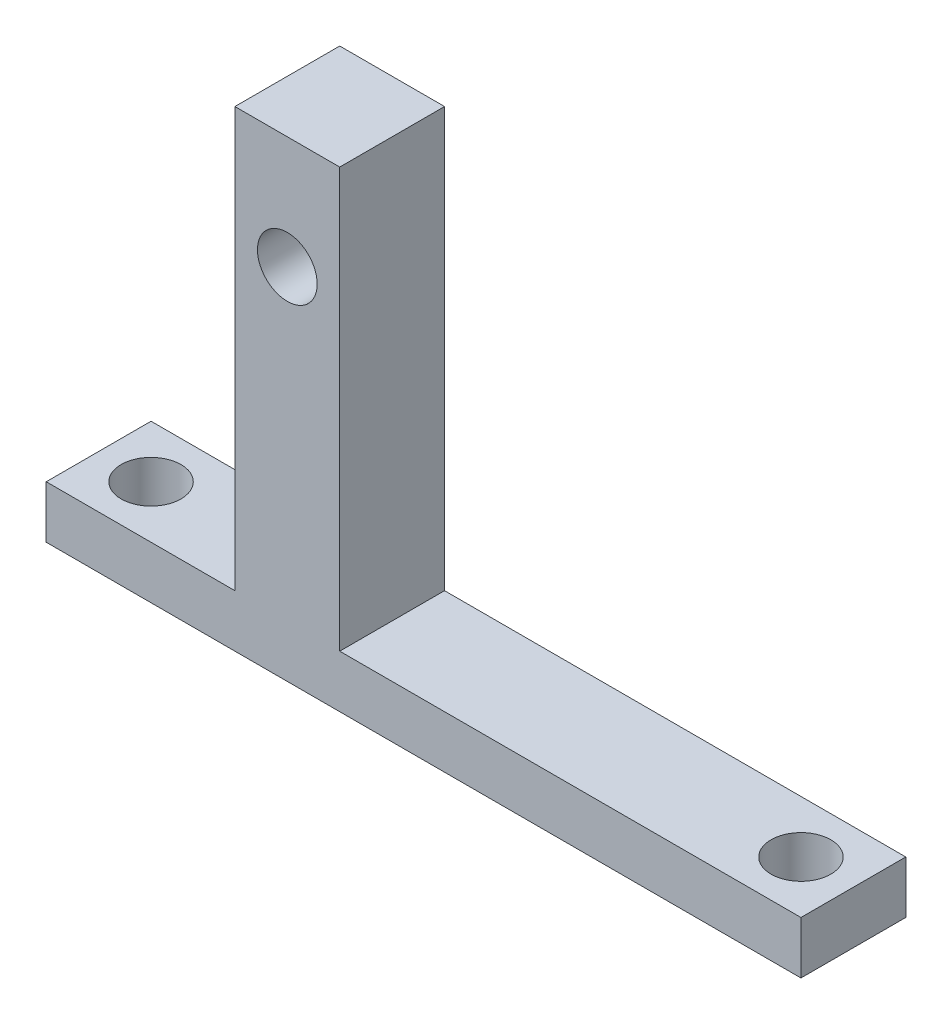
from build123d import *

# Parameters (mm, degrees)
SKETCH1_W           = 54.864
SKETCH1_H           = 7.62
BOSS_EXTRUDE1_DEPTH = 3.81
SKETCH2_R           = 2.1717
CUT_EXTRUDE2_DEPTH  = 3.81
SKETCH5_W           = 7.62
SKETCH5_H           = 7.62
BOSS_EXTRUDE2_DEPTH = 30.48
SKETCH6_R           = 2.1717
CUT_EXTRUDE3_DEPTH  = 7.62


with BuildPart() as part:
    # Sketch1 → Boss-Extrude1 (new body)
    with BuildSketch(Plane(origin=(0, 0, 0), x_dir=(1, 0, 0), z_dir=(0, 1, 0))):
        with Locations((2.806390244, -28.85997561)):
            Rectangle(SKETCH1_W, SKETCH1_H)
    extrude(amount=BOSS_EXTRUDE1_DEPTH)

    # Sketch2 → Cut-Extrude2 (cut)
    with BuildSketch(Plane(origin=(0, 3.81, 0), x_dir=(1, 0, 0), z_dir=(0, 1, 0))):
        with Locations(Location((-20.815609756, -28.85997561, 0), (0, 0, 270))):
            Circle(SKETCH2_R)
        with Locations(Location((26.428390244, -28.85997561, 0), (0, 0, 270))):
            Circle(SKETCH2_R)
    extrude(amount=-CUT_EXTRUDE2_DEPTH, mode=Mode.SUBTRACT)

    # Sketch5 → Boss-Extrude2 (add)
    with BuildSketch(Plane(origin=(0, 3.81, 0), x_dir=(1, 0, 0), z_dir=(0, 1, 0))):
        with Locations((-7.099609756, -28.85997561)):
            Rectangle(SKETCH5_W, SKETCH5_H)
    extrude(amount=BOSS_EXTRUDE2_DEPTH)

    # Sketch6 → Cut-Extrude3 (cut)
    with BuildSketch(Plane.XY.offset(32.66997561)):
        with Locations((-7.099609756, 26.0985)):
            Circle(SKETCH6_R)
    extrude(amount=-CUT_EXTRUDE3_DEPTH, mode=Mode.SUBTRACT)


solid = part.part
